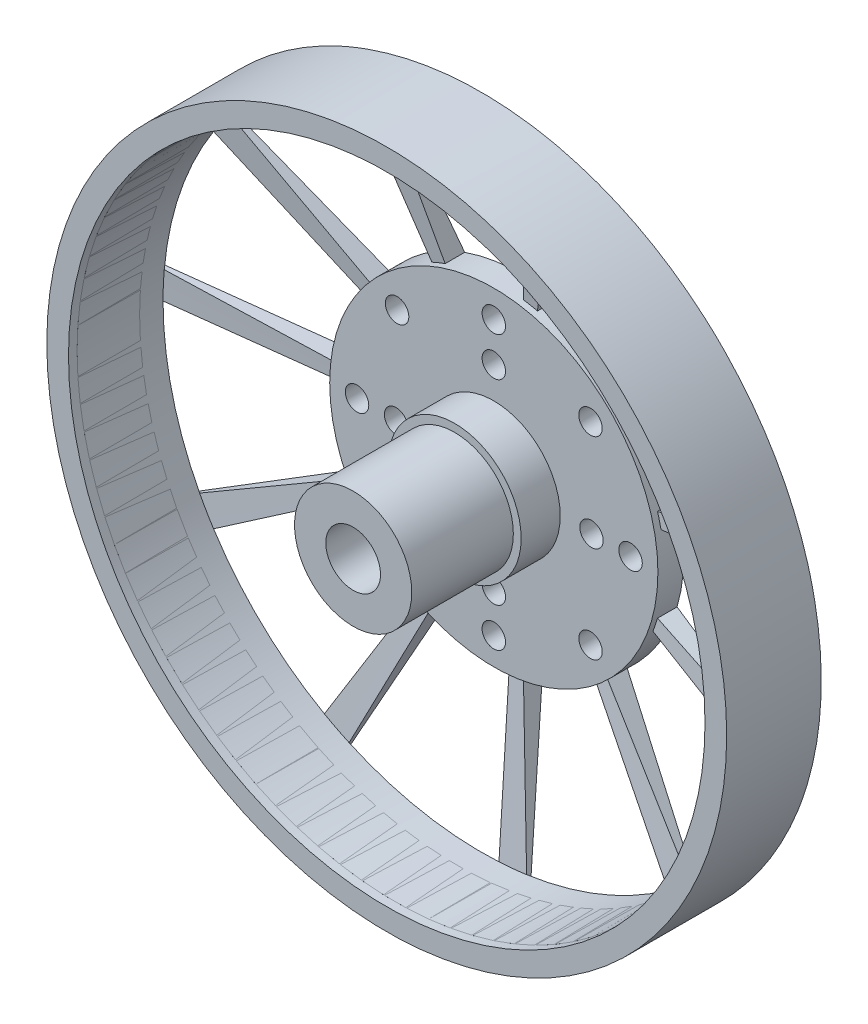
from build123d import *

# Parameters (mm, degrees)
BOSS_EXTRUDE1_START = 4.9
SKETCH1_R           = 43.5
SKETCH1_R_2         = 40.725
BOSS_EXTRUDE1_DEPTH = 12.1
SKETCH1_4_R         = 21
SKETCH1_4_R_2       = 7.5
SKETCH1_4_R_3       = 5.25
BOSS_EXTRUDE2_DEPTH = 3.3
REVOLVE1_ANGLE      = 5
CIRPATTERN1_COUNT   = 11
SKETCH3_R           = 7.5
SKETCH3_R_2         = 3.5
BOSS_EXTRUDE3_DEPTH = 18
SKETCH4_R           = 8.5
SKETCH4_R_2         = 3.5
BOSS_EXTRUDE4_DEPTH = 5
SKETCH6_R           = 1.5
CUT_EXTRUDE1_DEPTH  = 5
BOSS_EXTRUDE5_START = -1.1
SKETCH7_R           = 43.25
SKETCH7_R_2         = 40.725
BOSS_EXTRUDE5_DEPTH = 8


with BuildPart() as part:
    # Sketch1 → Boss-Extrude1 (new body)
    with BuildSketch(Plane.XY.offset(BOSS_EXTRUDE1_START)):
        Circle(SKETCH1_R)
        Circle(SKETCH1_R_2, mode=Mode.SUBTRACT)
    extrude(amount=BOSS_EXTRUDE1_DEPTH)



with BuildPart() as body_2:
    # Sketch1<4> → Boss-Extrude2 (new body)
    # profile 1 of 2: a face of its own
    with BuildSketch(Plane.XY):
        Circle(SKETCH1_4_R)
        Circle(SKETCH1_4_R_2, mode=Mode.SUBTRACT)
    # profile 2 of 2: a face of its own
    with BuildSketch(Plane.XY):
        Circle(SKETCH1_4_R_2)
        Circle(SKETCH1_4_R_3, mode=Mode.SUBTRACT)
    extrude(amount=BOSS_EXTRUDE2_DEPTH)


with BuildPart() as part_1:
    add(part.part)

    add(body_2.part)  # Revolve1 merges body 2
    # Sketch2 → Revolve1 (revolve)
    with BuildSketch(Plane(origin=(0, 0, 0), x_dir=(1, 0, 0), z_dir=(0, 1, 0))):
        Polygon((-43.5, -4.9), (-40.725, -4.9), (-21, -2.5), (-21, 0), align=None)
    revolve1 = revolve(axis=Axis((0, 0, 3.3), (0, 0, -1)), revolution_arc=REVOLVE1_ANGLE)

    # CirPattern1: Revolve1 ×11 about axis
    cirpattern1_axis = Axis((0, 0, 0), (0, 0, 1))
    for i in range(1, CIRPATTERN1_COUNT):
        add(revolve1.rotate(cirpattern1_axis, i * 360 / CIRPATTERN1_COUNT))

    # Sketch3 → Boss-Extrude3 (add)
    with BuildSketch(Plane.XY.offset(3.3)):
        Circle(SKETCH3_R)
        Circle(SKETCH3_R_2, mode=Mode.SUBTRACT)
    extrude(amount=BOSS_EXTRUDE3_DEPTH)

    # Sketch4 → Boss-Extrude4 (add)
    with BuildSketch(Plane.XY.offset(3.3)):
        Circle(SKETCH4_R)
        Circle(SKETCH4_R_2, mode=Mode.SUBTRACT)
    extrude(amount=BOSS_EXTRUDE4_DEPTH)

    # Sketch6 → Cut-Extrude1 (cut)
    with BuildSketch(Plane(origin=(0, 0, 0), x_dir=(-1, 0, 0), z_dir=(0, 0, -1))):
        with Locations((0, 12.5)):
            Circle(SKETCH6_R)
        with Locations((12.5, 0)):
            Circle(SKETCH6_R)
        with Locations((0, -12.5)):
            Circle(SKETCH6_R)
        with Locations((-12.5, 0)):
            Circle(SKETCH6_R)
        with Locations((0, 17.5)):
            Circle(SKETCH6_R)
        with Locations((12.374368671, 12.374368671)):
            Circle(SKETCH6_R)
        with Locations((17.5, 0)):
            Circle(SKETCH6_R)
        with Locations((12.374368671, -12.374368671)):
            Circle(SKETCH6_R)
        with Locations((0, -17.5)):
            Circle(SKETCH6_R)
        with Locations((-12.374368671, -12.374368671)):
            Circle(SKETCH6_R)
        with Locations((-17.5, 0)):
            Circle(SKETCH6_R)
        with Locations((-12.374368671, 12.374368671)):
            Circle(SKETCH6_R)
    extrude(amount=-CUT_EXTRUDE1_DEPTH, mode=Mode.SUBTRACT)


with BuildPart() as body_2_2:
    # Sketch7 → Boss-Extrude5 (new body)
    with BuildSketch(Plane.XY.offset(17).offset(BOSS_EXTRUDE5_START)):
        Circle(SKETCH7_R)
        Circle(SKETCH7_R_2, mode=Mode.SUBTRACT)
    extrude(amount=-BOSS_EXTRUDE5_DEPTH)


solid = Compound([part_1.part, body_2_2.part])
